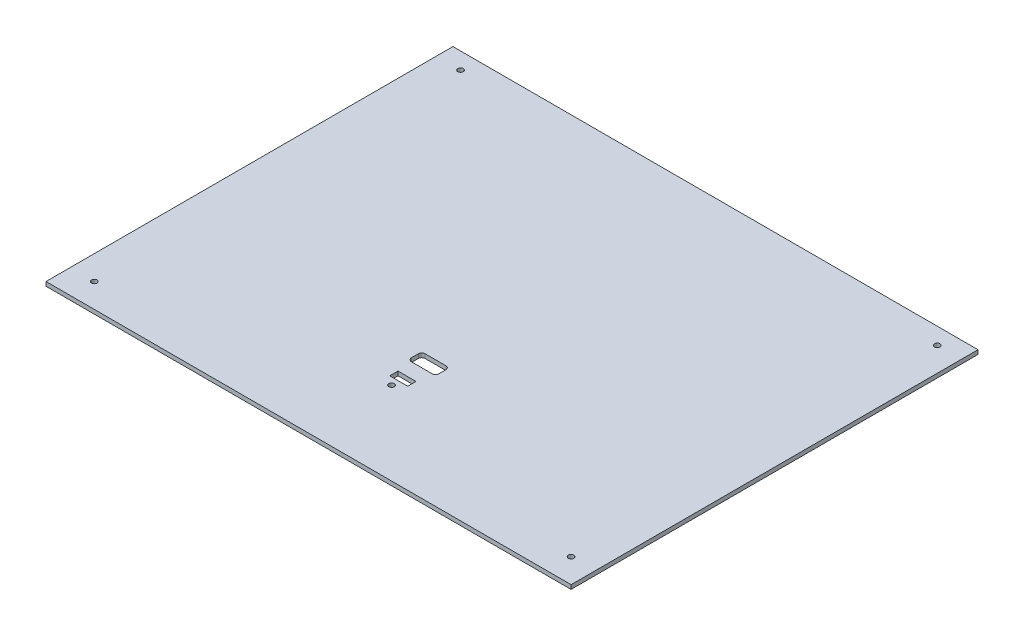
from build123d import *

# Parameters (mm, degrees)
SKETCH1_W           = 380
SKETCH1_H           = 294.5
BOSS_EXTRUDE1_DEPTH = 3
SKETCH3_R           = 2
SKETCH3_W           = 13
SKETCH3_H           = 6
SKETCH3_W_2         = 20
SKETCH3_H_2         = 10
CUT_EXTRUDE1_DEPTH  = 3
FILLET1_R           = 2.5


with BuildPart() as part:
    # Sketch1 → Boss-Extrude1 (new body)
    with BuildSketch(Plane(origin=(0, 0, 0), x_dir=(1, 0, 0), z_dir=(0, 1, 0))):
        Rectangle(SKETCH1_W, SKETCH1_H)
    extrude(amount=BOSS_EXTRUDE1_DEPTH)

    # Sketch3 → Cut-Extrude1 (cut)
    with BuildSketch(Plane(origin=(0, 3, 0), x_dir=(1, 0, 0), z_dir=(0, 1, 0))):
        with Locations(Location((-172.5, 135.25, 0), (0, 0, 270))):
            Circle(SKETCH3_R)
        with Locations(Location((-172.5, -129.75, 0), (0, 0, 270))):
            Circle(SKETCH3_R)
        with Locations(Location((172.5, -129.75, 0), (0, 0, 270))):
            Circle(SKETCH3_R)
        with Locations(Location((172.5, 135.25, 0), (0, 0, 270))):
            Circle(SKETCH3_R)
        with Locations(Location((0, -87.15, 0), (0, 0, 270))):
            Circle(SKETCH3_R)
        with Locations((0, -79)):
            Rectangle(SKETCH3_W, SKETCH3_H)
        with Locations((0, -60.337381091)):
            Rectangle(SKETCH3_W_2, SKETCH3_H_2)
    extrude(amount=-CUT_EXTRUDE1_DEPTH, mode=Mode.SUBTRACT)

    # Fillet1
    fillet1_edges = [part.edges().sort_by_distance(p)[0] for p in [
        (-10, 1.5, 65.337381091),
        (-10, 1.5, 55.337381091),
        (10, 1.5, 55.337381091),
        (10, 1.5, 65.337381091),
    ]]
    fillet(fillet1_edges, radius=FILLET1_R)


solid = part.part
